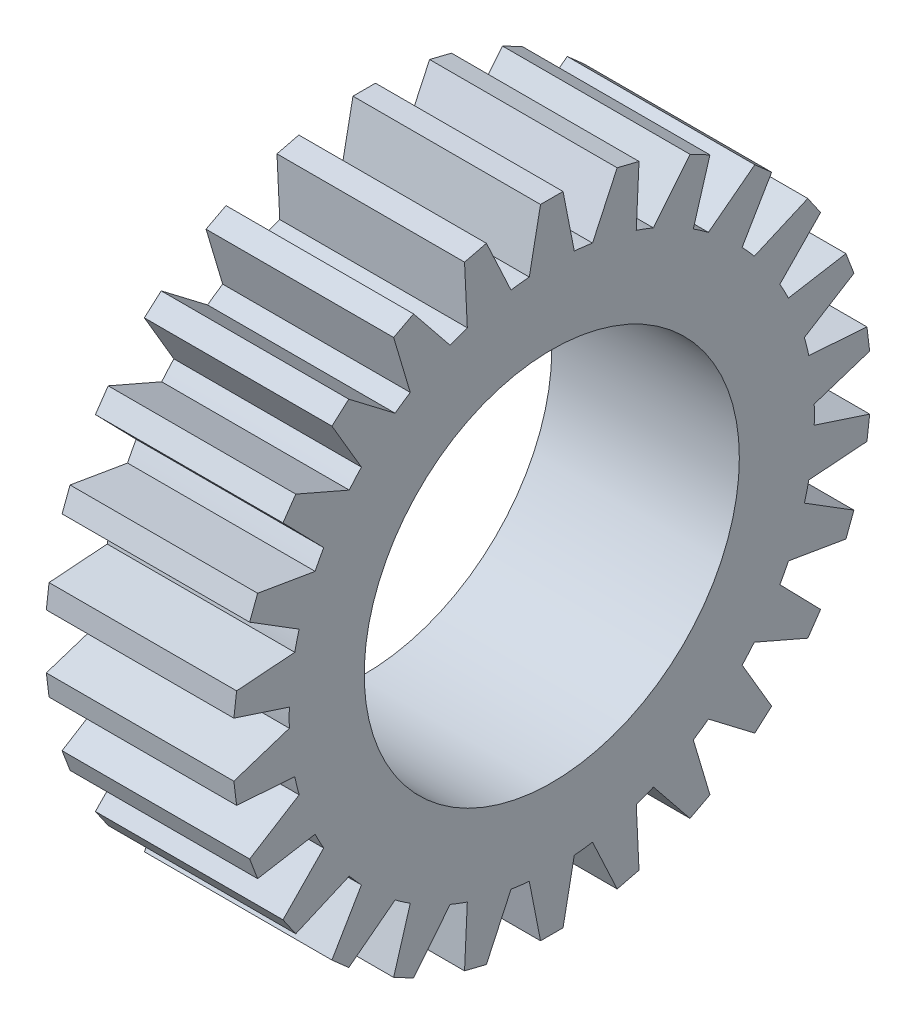
from build123d import *

# Parameters (mm, degrees)
SKETCH1_R           = 10
BOSS_EXTRUDE1_DEPTH = 5
BOSS_EXTRUDE2_DEPTH = 5
CIRPATTERN1_COUNT   = 26


with BuildPart() as part:
    # Sketch1 → Boss-Extrude1 (new, symmetric)
    with BuildSketch(Plane.YZ):
        with BuildLine():
            ThreePointArc((14, 0), (13.987113224, 0.600552799), (13.948476619, 1.2))
            ThreePointArc((13.948476619, 1.2), (-14, 0), (13.948476619, -1.2))
            ThreePointArc((13.948476619, -1.2), (13.987113224, -0.600552799), (14, 0))
        make_face()
        Circle(SKETCH1_R, mode=Mode.SUBTRACT)
    extrude(amount=BOSS_EXTRUDE1_DEPTH, both=True)

    # Sketch1<3> → Boss-Extrude2 (add, symmetric)
    with BuildSketch(Plane.YZ):
        with BuildLine():
            Line((17, -0.6), (17, 0.6))
            Line((17, 0.6), (13.948476619, 1.2))
            ThreePointArc((13.948476619, 1.2), (13.987113224, 0.600552799), (14, 0))
            ThreePointArc((14, 0), (13.987113224, -0.600552799), (13.948476619, -1.2))
            Line((13.948476619, -1.2), (17, -0.6))
        make_face()
    boss_extrude2 = extrude(amount=BOSS_EXTRUDE2_DEPTH, both=True)

    # CirPattern1: Boss-Extrude2 ×26 about axis
    cirpattern1_axis = Axis((5, 0, 0), (1, 0, 0))
    for i in range(1, CIRPATTERN1_COUNT):
        add(boss_extrude2.rotate(cirpattern1_axis, i * 360 / CIRPATTERN1_COUNT))


solid = part.part
